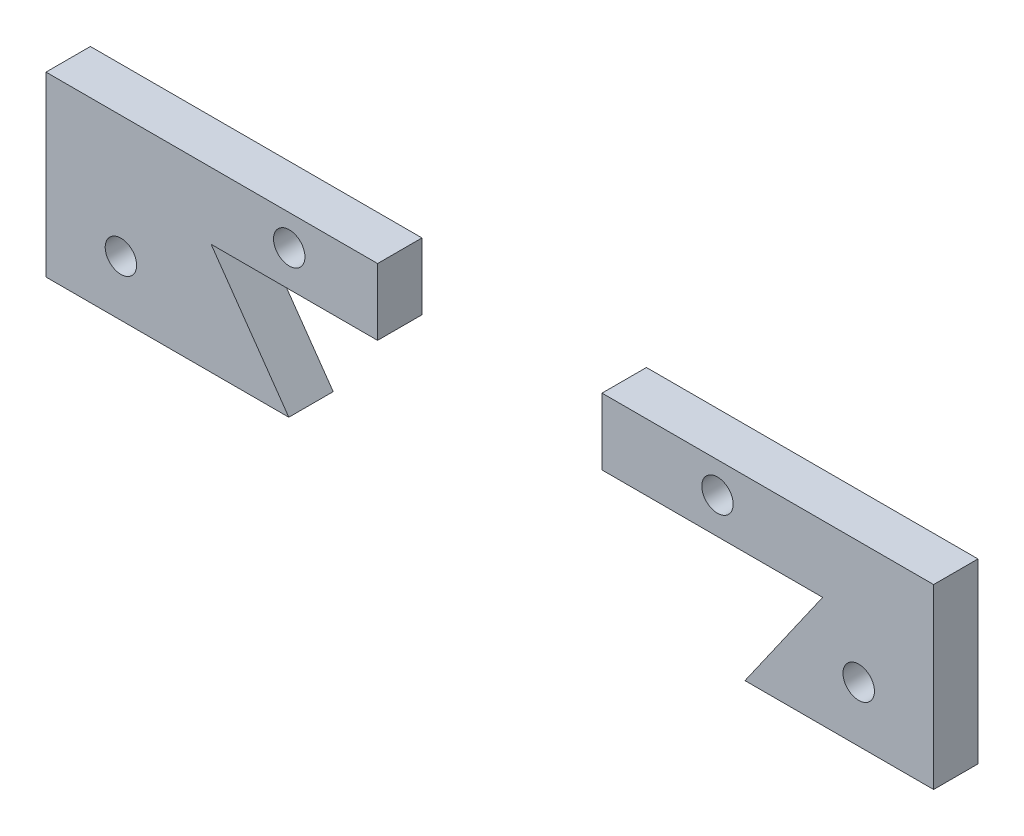
from build123d import *

# Parameters (mm, degrees)
BOSS_EXTRUDE1_DEPTH            = 6.35
BOSS_EXTRUDE1_2_DEPTH          = 6.35
SKETCH3_W                      = 2.2479
SKETCH3_H                      = 6.35
F_8_CLEARANCE_HOLE1_AT_2_COUNT = 2
F_8_CLEARANCE_HOLE1_AT_2_PITCH = 27.409736217
F_8_CLEARANCE_HOLE1_AT_3_COUNT = 2
F_8_CLEARANCE_HOLE1_AT_3_PITCH = 86.352641558
F_8_CLEARANCE_HOLE1_AT_4_COUNT = 2
F_8_CLEARANCE_HOLE1_AT_4_PITCH = 105.567102665


with BuildPart() as part:
    # Sketch1 → Boss-Extrude1 (new body)
    with BuildSketch(Plane.XY):
        Polygon((100.009205331, 0), (127, 0), (127, 25.4), (79.556336319, 25.4), (79.556336319, 15.875), (111.125, 15.875), align=None)
    extrude(amount=BOSS_EXTRUDE1_DEPTH)


with BuildPart() as body_2:
    # Sketch1 → Boss-Extrude1 2 (new body)
    with BuildSketch(Plane.XY):
        Polygon((0, 0), (0, 25.4), (47.443663681, 25.4), (47.443663681, 15.875), (23.626918639, 15.875), (34.742713308, 0), align=None)
    extrude(amount=BOSS_EXTRUDE1_2_DEPTH)

    # Sketch3 → #8 Clearance Hole1 (revolve, cut)
    with BuildSketch(Plane(origin=(10.716448667, 7.9375, 6.35), x_dir=(0, -1, 0), z_dir=(1, 0, 0))):
        with Locations((1.12395, 3.175)):
            Rectangle(SKETCH3_W, SKETCH3_H)
    f_8_clearance_hole1 = revolve(axis=Axis((10.716448667, 7.9375, 12.7), (0, 0, -1)), mode=Mode.SUBTRACT)

    # #8 Clearance Hole1 at 2: #8 Clearance Hole1 ×2
    with Locations(*[Vector(0.8787734442616352, 0.47723917867306637, 0) * (i * F_8_CLEARANCE_HOLE1_AT_2_PITCH) for i in range(1, F_8_CLEARANCE_HOLE1_AT_2_COUNT)]):
        add(f_8_clearance_hole1, mode=Mode.SUBTRACT)


with BuildPart() as part_1:
    add(part.part)

    # #8 Clearance Hole1 at 3: #8 Clearance Hole1 ×2
    with Locations(*[Vector(0.9884597870181576, 0.15148349562912322, 0) * (i * F_8_CLEARANCE_HOLE1_AT_3_PITCH) for i in range(1, F_8_CLEARANCE_HOLE1_AT_3_COUNT)]):
        add(f_8_clearance_hole1, mode=Mode.SUBTRACT)

    # #8 Clearance Hole1 at 4: #8 Clearance Hole1 ×2
    with Locations(*[(i * F_8_CLEARANCE_HOLE1_AT_4_PITCH, 0, 0) for i in range(1, F_8_CLEARANCE_HOLE1_AT_4_COUNT)]):
        add(f_8_clearance_hole1, mode=Mode.SUBTRACT)


solid = Compound([body_2.part, part_1.part])
